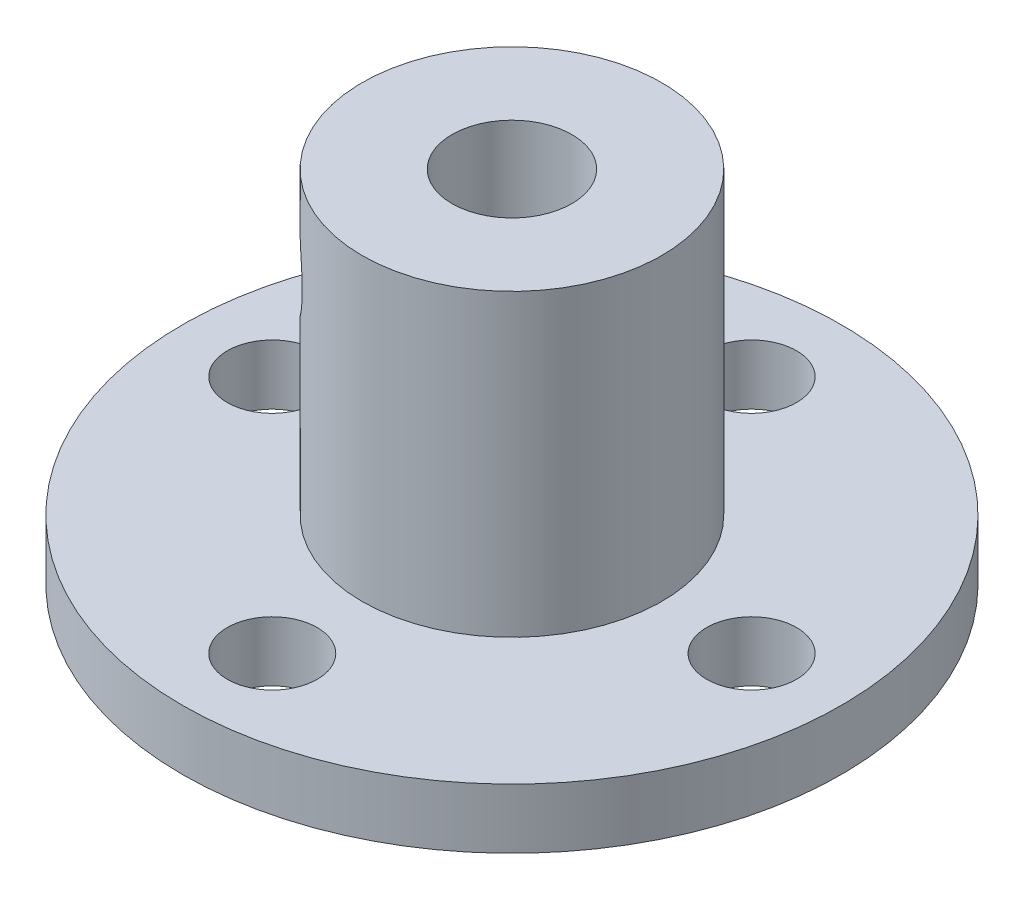
from build123d import *

# Parameters (mm, degrees)
SKETCH1_R               = 11
SKETCH1_R_2             = 1.5
SKETCH1_R_3             = 5
BOSS_EXTRUDE1_DEPTH     = 2
SKETCH1_3_R             = 5
SKETCH1_3_R_2           = 2
BOSS_EXTRUDE2_DEPTH     = 12
CUT_EXTRUDE1_REACH      = 25.759
CUT_EXTRUDE1_END_RADIUS = 2
SKETCH2_R               = 1.5


with BuildPart() as part:
    # Sketch1 → Boss-Extrude1 (new body)
    with BuildSketch(Plane(origin=(0, 0, 0), x_dir=(1, 0, 0), z_dir=(0, 1, 0))):
        Circle(SKETCH1_R)
        with Locations((-8, 0)):
            Circle(SKETCH1_R_2, mode=Mode.SUBTRACT)
        with Locations((0, -8)):
            Circle(SKETCH1_R_2, mode=Mode.SUBTRACT)
        Circle(SKETCH1_R_3, mode=Mode.SUBTRACT)
        with Locations((8, 0)):
            Circle(SKETCH1_R_2, mode=Mode.SUBTRACT)
        with Locations((0, 8)):
            Circle(SKETCH1_R_2, mode=Mode.SUBTRACT)
    extrude(amount=BOSS_EXTRUDE1_DEPTH)

    # Sketch1<3> → Boss-Extrude2 (add)
    with BuildSketch(Plane(origin=(0, 0, 0), x_dir=(1, 0, 0), z_dir=(0, 1, 0))):
        Circle(SKETCH1_3_R)
        Circle(SKETCH1_3_R_2, mode=Mode.SUBTRACT)
    extrude(amount=BOSS_EXTRUDE2_DEPTH)

    # Cut-Extrude1: up to this cylinder (the profile starts outside it)
    cut_extrude1_end = Plane(origin=(0, 9, 0), z_dir=(0, -1, 0)) * Cylinder(CUT_EXTRUDE1_END_RADIUS, 56.518, mode=Mode.PRIVATE)
    # Sketch2 → Cut-Extrude1 (cut, up to the surface)
    with BuildSketch(Plane(origin=(-4.0625, 0, 2.914805954), x_dir=(0.582961190817979, 0, 0.8125000000000517), z_dir=(-0.8125000000000517, 0, 0.582961190817979)), mode=Mode.PRIVATE) as cut_extrude1_sk1:
        with Locations((0, 9)):
            Circle(SKETCH2_R)
    cut_extrude1_tool1 = extrude(cut_extrude1_sk1.sketch, amount=-CUT_EXTRUDE1_REACH, mode=Mode.PRIVATE) - cut_extrude1_end
    add(cut_extrude1_tool1.solids().sort_by_distance((-4.0625, 9, 2.914806))[0], mode=Mode.SUBTRACT)


solid = part.part
